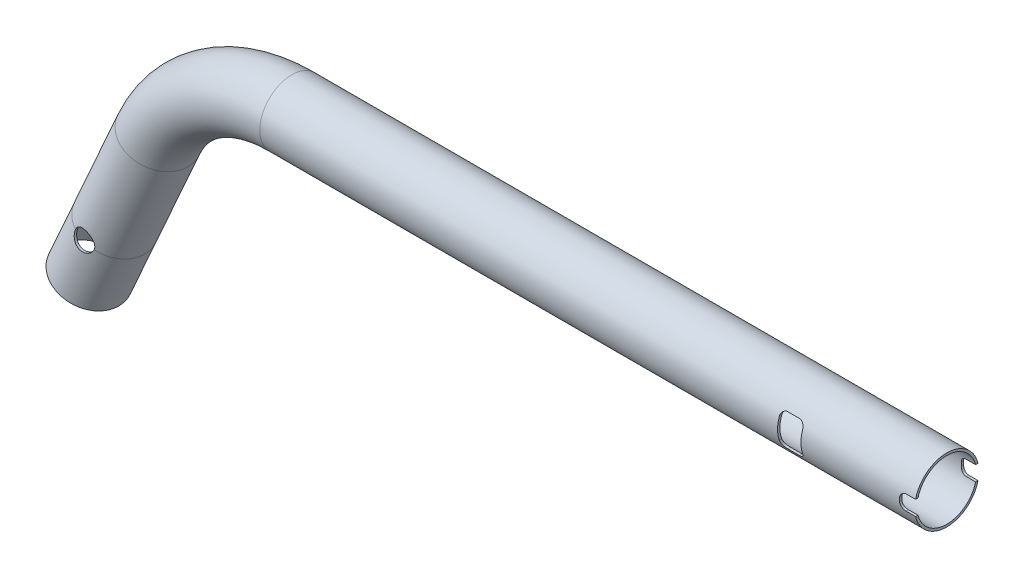
from build123d import *

# Parameters (mm, degrees)
SKETCH3_R               = 11
SKETCH3_R_2             = 10.2
CUT_EXTRUDE1_REACH      = 193.55
SKETCH4_R               = 3.5
SKETCH5_R               = 3.3
CUT_EXTRUDE2_DEPTH      = 192.550018952
CUT_EXTRUDE3_DEPTH      = 192.550018952
CUT_EXTRUDE3_DEPTH_BACK = 192.550018952


with BuildPart() as part:
    # Sweep2: sweep along a path in Sketch1
    with BuildLine(Plane.XY) as sweep2_path:
        Line((133.740106583, 0), (90.740106583, 0))
        Line((90.740106583, 0), (-90.740106583, 0))
        ThreePointArc((-90.740106583, 0), (-117.972058334, -8.066471603), (-136.417379465, -29.663167846))
        Line((-136.417379465, -29.663167846), (-151.259893417, -63))
        Line((-151.259893417, -63), (-160.090880321, -82.834721336))
    # Sketch3 → Sweep2 (sweep)
    with BuildSketch(Plane(origin=(90.740106583, 0, 0), x_dir=(0, 0, -1), z_dir=(1, 0, 0))):
        Circle(SKETCH3_R)
        Circle(SKETCH3_R_2, mode=Mode.SUBTRACT)
    sweep(path=sweep2_path.line)

    # Sketch4 → Cut-Extrude1 (cut, up to next)
    with BuildSketch(Plane.XY, mode=Mode.PRIVATE) as cut_extrude1_sk1:
        with Locations((-151.259893417, -63)):
            Circle(SKETCH4_R)
    cut_extrude1_tool1 = extrude(cut_extrude1_sk1.sketch, amount=CUT_EXTRUDE1_REACH, mode=Mode.PRIVATE) & part.part
    # Sketch4 → Cut-Extrude1 (cut, up to next)
    with BuildSketch(Plane.XY, mode=Mode.PRIVATE) as cut_extrude1_sk2:
        with BuildLine():
            Line((88.740106583, -5.5), (92.740106583, -5.5))
            ThreePointArc((92.740106583, -5.5), (94.154320145, -4.914213562), (94.740106583, -3.5))
            Line((94.740106583, -3.5), (94.740106583, 3.5))
            ThreePointArc((94.740106583, 3.5), (94.154320145, 4.914213562), (92.740106583, 5.5))
            Line((92.740106583, 5.5), (88.740106583, 5.5))
            ThreePointArc((88.740106583, 5.5), (87.32589302, 4.914213562), (86.740106583, 3.5))
            Line((86.740106583, 3.5), (86.740106583, -3.5))
            ThreePointArc((86.740106583, -3.5), (87.32589302, -4.914213562), (88.740106583, -5.5))
        make_face()
    cut_extrude1_tool2 = extrude(cut_extrude1_sk2.sketch, amount=CUT_EXTRUDE1_REACH, mode=Mode.PRIVATE) & part.part
    add(cut_extrude1_tool1.solids().sort_by_distance((-151.259893, -63, 0))[0], mode=Mode.SUBTRACT)
    add(cut_extrude1_tool2.solids().sort_by_distance((90.740107, 0, 0))[0], mode=Mode.SUBTRACT)

    # Sketch5 → Cut-Extrude2 (cut, through all)
    with BuildSketch(Plane.XY):
        with Locations((-151.259893417, -63)):
            Circle(SKETCH5_R)
    extrude(amount=-CUT_EXTRUDE2_DEPTH, mode=Mode.SUBTRACT)

    # Sketch6 → Cut-Extrude3 (cut, two sides: drawn at the far end of the back side and taken through both)
    with BuildSketch(Plane.XY.offset(-CUT_EXTRUDE3_DEPTH_BACK)):
        with BuildLine():
            Line((133.813892638, 2.554733627), (133.740106583, -2.554733627))
            Line((133.740106583, -2.554733627), (130.540106583, -2.554733627))
            ThreePointArc((130.540106583, -2.554733627), (129.12589302, -1.968947189), (128.540106583, -0.554733627))
            Line((128.540106583, -0.554733627), (128.540106583, 0.554733627))
            ThreePointArc((128.540106583, 0.554733627), (129.12589302, 1.968947189), (130.540106583, 2.554733627))
            Line((130.540106583, 2.554733627), (133.813892638, 2.554733627))
        make_face()
    extrude(amount=CUT_EXTRUDE3_DEPTH + CUT_EXTRUDE3_DEPTH_BACK, mode=Mode.SUBTRACT)


solid = part.part
